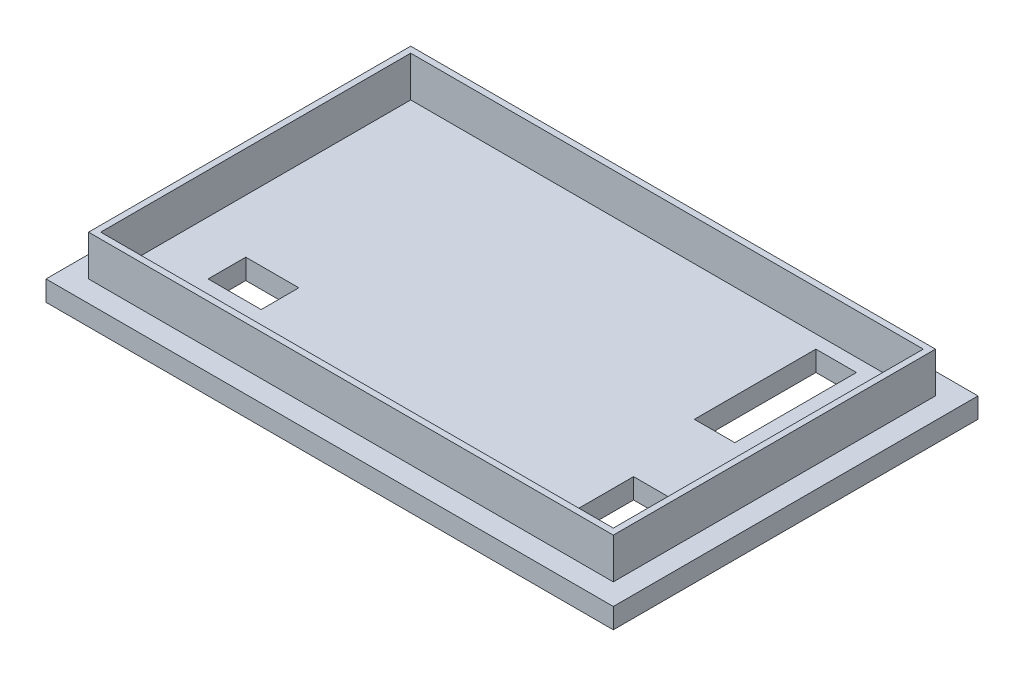
from build123d import *

# Parameters (mm, degrees)
CROQUIS1_W              = 140
CROQUIS1_H              = 90
SALIENTE_EXTRUIR1_DEPTH = 5
CROQUIS2_W              = 129.5
CROQUIS2_H              = 79.5
CROQUIS2_W_2            = 126.5
CROQUIS2_H_2            = 76.5
SALIENTE_EXTRUIR2_DEPTH = 10
CROQUIS3_W              = 15
CROQUIS3_H              = 20
CORTAR_EXTRUIR1_DEPTH   = 84.815273071
CROQUIS4_W              = 13.1
CROQUIS4_H              = 9.3
CORTAR_EXTRUIR2_DEPTH   = 85.557672626
CROQUIS5_W              = 10
CROQUIS5_H              = 30
CORTAR_EXTRUIR3_DEPTH   = 85.557672626


with BuildPart() as part:
    # Croquis1 → Saliente-Extruir1 (new body)
    with BuildSketch(Plane(origin=(0, 0, 0), x_dir=(1, 0, 0), z_dir=(0, 1, 0))):
        Rectangle(CROQUIS1_W, CROQUIS1_H)
    extrude(amount=SALIENTE_EXTRUIR1_DEPTH)

    # Croquis2 → Saliente-Extruir2 (add)
    with BuildSketch(Plane(origin=(0, 5, 0), x_dir=(1, 0, 0), z_dir=(0, 1, 0))):
        Rectangle(CROQUIS2_W, CROQUIS2_H)
        Rectangle(CROQUIS2_W_2, CROQUIS2_H_2, mode=Mode.SUBTRACT)
    extrude(amount=SALIENTE_EXTRUIR2_DEPTH)

    # Croquis3 → Cortar-Extruir1 (cut, through all)
    with BuildSketch(Plane(origin=(0, 5, 0), x_dir=(1, 0, 0), z_dir=(0, 1, 0))):
        with Locations((52.25, -24.75)):
            Rectangle(CROQUIS3_W, CROQUIS3_H)
    extrude(amount=-CORTAR_EXTRUIR1_DEPTH, mode=Mode.SUBTRACT)

    # Croquis4 → Cortar-Extruir2 (cut, through all)
    with BuildSketch(Plane.XZ):
        with Locations((-43.45, 20.35)):
            Rectangle(CROQUIS4_W, CROQUIS4_H)
    extrude(amount=-CORTAR_EXTRUIR2_DEPTH, mode=Mode.SUBTRACT)

    # Croquis5 → Cortar-Extruir3 (cut, through all)
    with BuildSketch(Plane.XZ):
        with Locations((45, -20)):
            Rectangle(CROQUIS5_W, CROQUIS5_H)
    extrude(amount=-CORTAR_EXTRUIR3_DEPTH, mode=Mode.SUBTRACT)


solid = part.part
